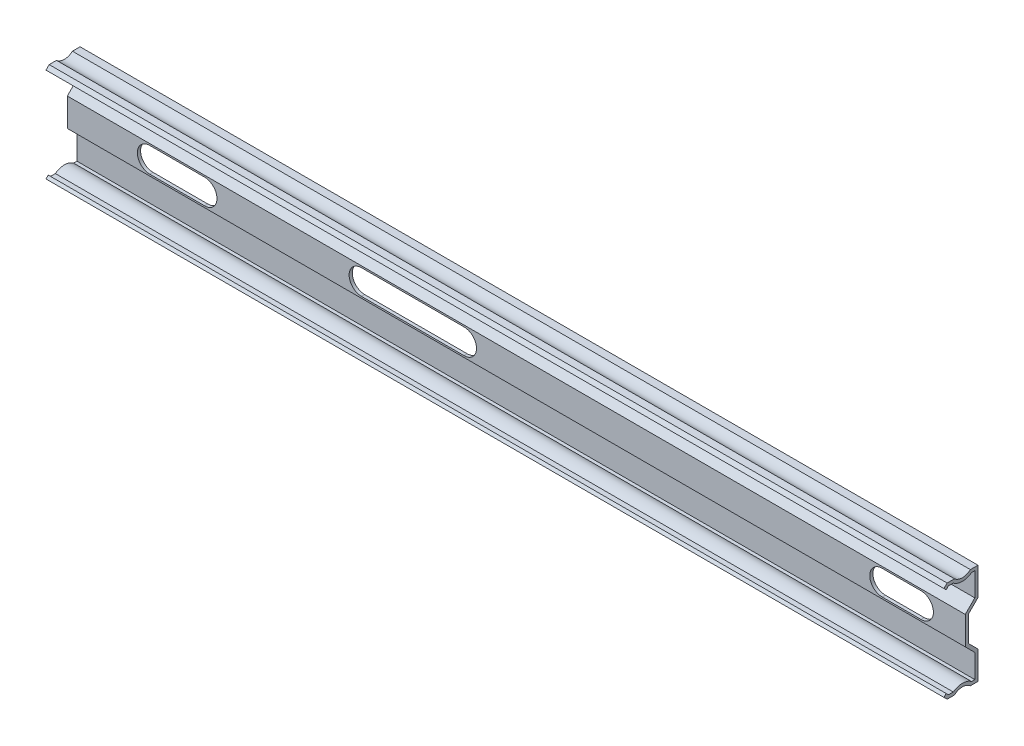
from build123d import *

# Parameters (mm, degrees)
EXTRUDE_THIN1_DEPTH   = 282
CORTE_EXTRUS_O1_DEPTH = 283.522008592


with BuildPart() as part:
    # Sketch1 → Extrude-Thin1 (new body)
    with BuildSketch(Plane(origin=(0, 0, 0), x_dir=(0, 0, -1), z_dir=(1, 0, 0))):
        with BuildLine():
            Line((-12.7, 14.804915028), (-11.7, 15.804915028))
            Line((-11.7, 15.804915028), (-9.401071342, 15.804915028))
            ThreePointArc((-9.401071342, 15.804915028), (-6.901071342, 14.85), (-4.401071342, 15.804915028))
            Line((-4.401071342, 15.804915028), (-2, 15.804915028))
            Line((-2, 15.804915028), (-2, 7))
            Line((-2, 7), (-5, 4))
            Line((-5, 4), (-5, -4))
            Line((-5, -4), (-2, -7))
            Line((-2, -7), (-2, -15.804915028))
            Line((-2, -15.804915028), (-4.401071342, -15.804915028))
            ThreePointArc((-4.401071342, -15.804915028), (-6.901071342, -14.85), (-9.401071342, -15.804915028))
            Line((-9.401071342, -15.804915028), (-11.7, -15.804915028))
            Line((-11.7, -15.804915028), (-12.7, -14.804915028))
            Line((-12.7, -14.804915028), (-11.992893219, -14.097808247))
            Line((-11.992893219, -14.097808247), (-11.285786438, -14.804915028))
            Line((-11.285786438, -14.804915028), (-9.757612967, -14.804915028))
            ThreePointArc((-9.757612967, -14.804915028), (-6.901071342, -13.85), (-4.044529716, -14.804915028))
            Line((-4.044529716, -14.804915028), (-3, -14.804915028))
            Line((-3, -14.804915028), (-3, -7.414213562))
            Line((-3, -7.414213562), (-6, -4.414213562))
            Line((-6, -4.414213562), (-6, 4.414213562))
            Line((-6, 4.414213562), (-3, 7.414213562))
            Line((-3, 7.414213562), (-3, 14.804915028))
            Line((-3, 14.804915028), (-4.044529716, 14.804915028))
            ThreePointArc((-4.044529716, 14.804915028), (-6.901071342, 13.85), (-9.757612967, 14.804915028))
            Line((-9.757612967, 14.804915028), (-11.285786438, 14.804915028))
            Line((-11.285786438, 14.804915028), (-11.992893219, 14.097808247))
            Line((-11.992893219, 14.097808247), (-12.7, 14.804915028))
        make_face()
    extrude(amount=-EXTRUDE_THIN1_DEPTH)

    # Esboço1 → Corte-extrusão1 (cut, through all)
    with BuildSketch(Plane.XY.offset(6)):
        with BuildLine():
            Line((-13.9, -3.9), (-26.1, -3.9))
            ThreePointArc((-26.1, -3.9), (-30, 0), (-26.1, 3.9))
            Line((-26.1, 3.9), (-13.9, 3.9))
            ThreePointArc((-13.9, 3.9), (-10, 0), (-13.9, -3.9))
        make_face()
        with BuildLine():
            Line((-189.6, 3.9), (-157.4, 3.9))
            ThreePointArc((-157.4, 3.9), (-153.5, 0), (-157.4, -3.9))
            Line((-157.4, -3.9), (-189.6, -3.9))
            ThreePointArc((-189.6, -3.9), (-193.5, 0), (-189.6, 3.9))
        make_face()
        with BuildLine():
            Line((-256.1, 3.9), (-238.9, 3.9))
            ThreePointArc((-238.9, 3.9), (-235, 0), (-238.9, -3.9))
            Line((-238.9, -3.9), (-256.1, -3.9))
            ThreePointArc((-256.1, -3.9), (-260, 0), (-256.1, 3.9))
        make_face()
    extrude(amount=-CORTE_EXTRUS_O1_DEPTH, mode=Mode.SUBTRACT)


solid = part.part
